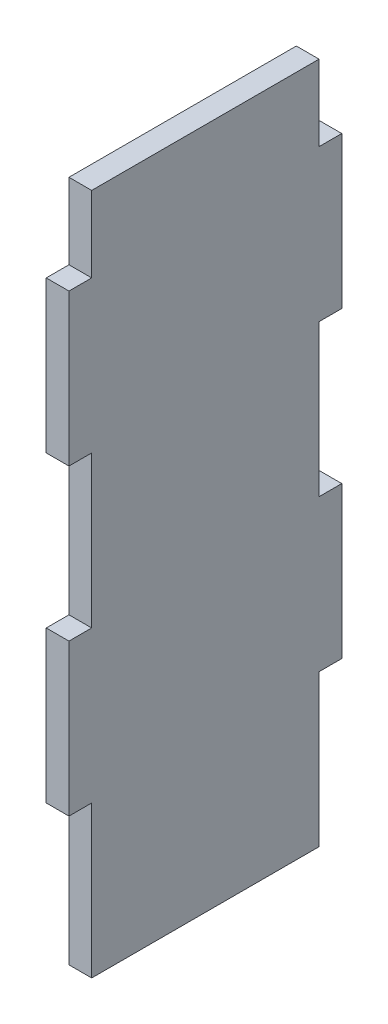
from build123d import *

# Parameters (mm, degrees)
BOSS_EXTRUDE1_DEPTH = 3


with BuildPart() as part:
    # Sketch1 → Boss-Extrude1 (new body)
    with BuildSketch(Plane(origin=(0, 0, 0), x_dir=(0, 0, -1), z_dir=(1, 0, 0))):
        Polygon((-15, 0), (15, 0), (15, 20), (18, 20), (18, 40), (15, 40), (15, 60), (18, 60), (18, 80), (15, 80), (15, 90), (-15, 90), (-15, 80), (-18, 80), (-18, 60), (-15, 60), (-15, 40), (-18, 40), (-18, 20), (-15, 20), align=None)
    extrude(amount=BOSS_EXTRUDE1_DEPTH)


solid = part.part
